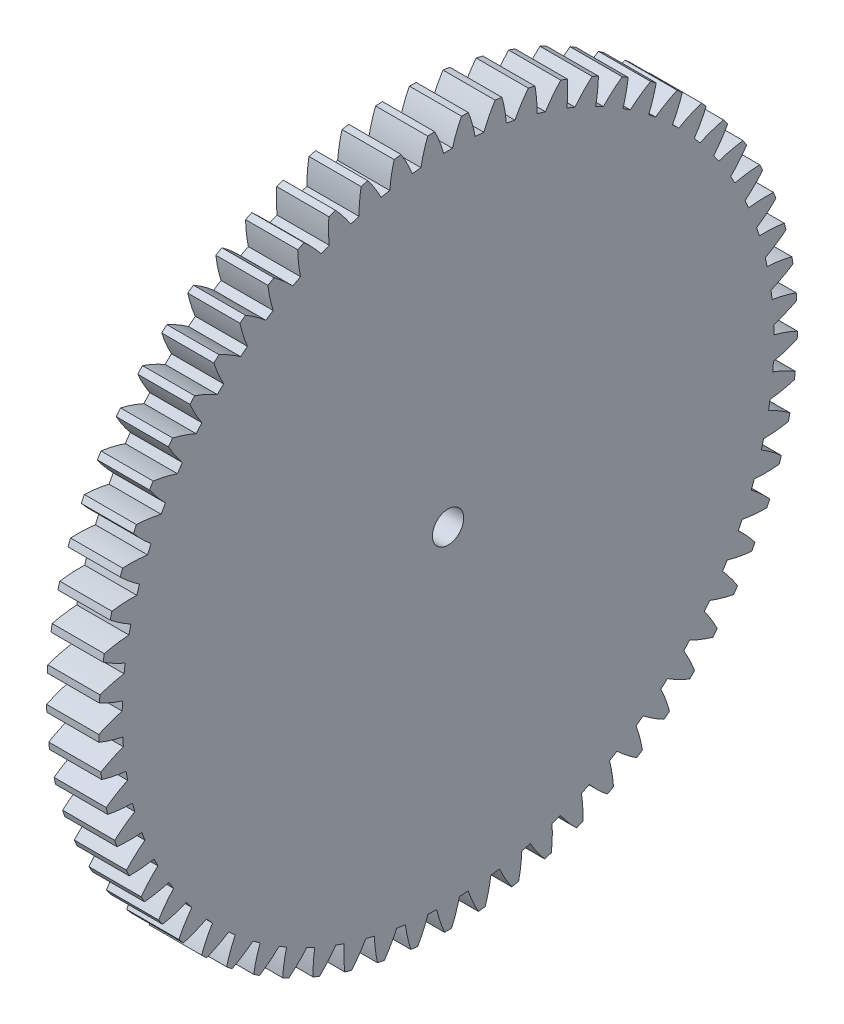
from build123d import *

# Parameters (mm, degrees)
BASPROSKE_W      = 10
BASPROSKE_H      = 67
TOOTHCUT_DEPTH   = 96.278539032
TEETHCUTS_COUNT  = 65
TEETHCUTS_ANGLE  = 354.461538462
HUBNEAONESKE_R   = 4
HUBNEARONE_DEPTH = 40.0000508
BORSKE_R         = 3
BORE_DEPTH       = 50.0000508


with BuildPart() as part:
    # BasProSke → Base-Revolve (revolve)
    with BuildSketch(Plane(origin=(0, 0, 0), x_dir=(1, 0, 0), z_dir=(0, 1, 0)), mode=Mode.PRIVATE) as base_revolve_sk:
        with Locations((5, 33.5)):
            Rectangle(BASPROSKE_W, BASPROSKE_H)
    revolve(base_revolve_sk.sketch.rotate(Axis((-10, 0, 0), (1, 0, 0)), 180), axis=Axis((-10, 0, 0), (1, 0, 0)))

    # TooCutSke → ToothCut (cut, through all)
    with BuildSketch(Plane(origin=(0, 0, 0), x_dir=(0, 0, -1), z_dir=(1, 0, 0))):
        with BuildLine():
            ThreePointArc((0.839587454, 62.493360399), (0, 62.499), (-0.839587454, 62.493360399))
            ThreePointArc((-0.839587454, 62.493360399), (-1.607833067, 64.774888384), (-2.583810833, 66.975578883))
            ThreePointArc((-2.583810833, 66.975578883), (0, 67.0254), (2.583810833, 66.975578883))
            ThreePointArc((2.583810833, 66.975578883), (1.607833067, 64.774888384), (0.839587454, 62.493360399))
        make_face()
    toothcut = extrude(amount=TOOTHCUT_DEPTH, mode=Mode.SUBTRACT)

    # TeethCuts: ToothCut ×65 about axis
    teethcuts_axis = Axis((-10, 0, 0), (1, 0, 0))
    for i in range(1, TEETHCUTS_COUNT):
        add(toothcut.rotate(teethcuts_axis, i * TEETHCUTS_ANGLE / (TEETHCUTS_COUNT - 1)), mode=Mode.SUBTRACT)

    # HubNeaOneSke → HubNearOne (add)
    with BuildSketch(Plane.ZY):
        with Locations(Location((0, 0, 0), (0, 0, 180))):
            Circle(HUBNEAONESKE_R)
    extrude(amount=HUBNEARONE_DEPTH)

    # BorSke → Bore (cut, symmetric)
    with BuildSketch(Plane(origin=(0, 0, 0), x_dir=(0, 0, -1), z_dir=(1, 0, 0))):
        with Locations(Location((0, 0, 0), (0, 0, 180))):
            Circle(BORSKE_R)
    extrude(amount=BORE_DEPTH, both=True, mode=Mode.SUBTRACT)


solid = part.part
